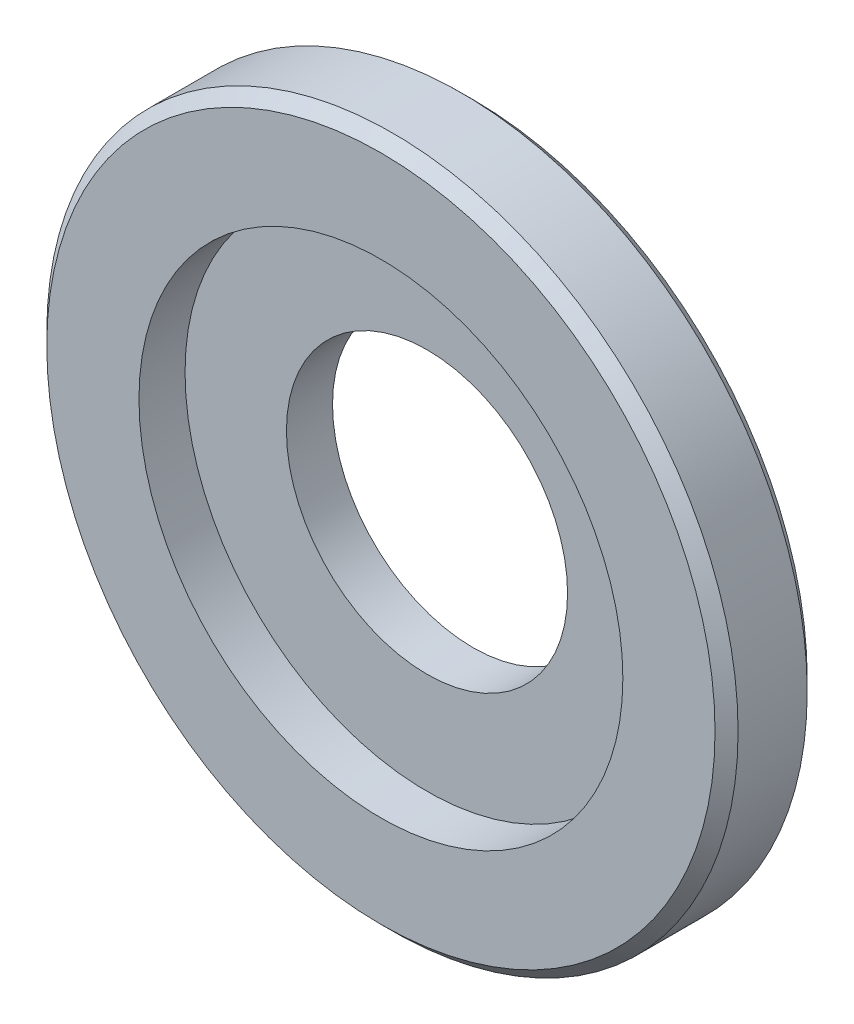
from build123d import *

# Parameters (mm, degrees)
ESQUISSE1_R             = 15
ESQUISSE1_R_2           = 6.1
BOSS_EXTRU_1_DEPTH      = 4
ESQUISSE2_R             = 10.5
ENL_V_MAT_EXTRU_1_DEPTH = 2
CHANFREIN1_SIZE         = 0.5


with BuildPart() as part:
    # Esquisse1 → Boss.-Extru.1 (new body)
    with BuildSketch(Plane.XY):
        Circle(ESQUISSE1_R)
        Circle(ESQUISSE1_R_2, mode=Mode.SUBTRACT)
    extrude(amount=BOSS_EXTRU_1_DEPTH)

    # Esquisse2 → Enlèv. mat.-Extru.1 (cut)
    with BuildSketch(Plane.XY.offset(4)):
        Circle(ESQUISSE2_R)
    extrude(amount=-ENL_V_MAT_EXTRU_1_DEPTH, mode=Mode.SUBTRACT)

    # Chanfrein1
    chanfrein1_edges = [part.edges().sort_by_distance(p)[0] for p in [
        (-15, 0, 0),
        (-15, 0, 4),
    ]]
    chamfer(chanfrein1_edges, length=CHANFREIN1_SIZE)


solid = part.part
